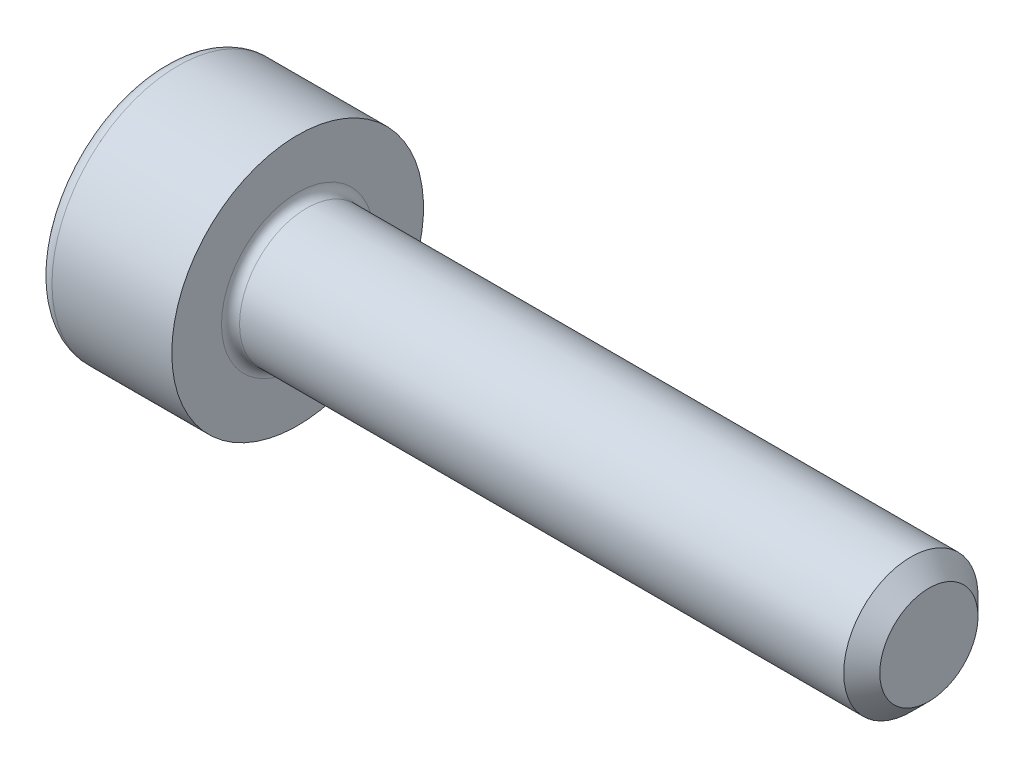
from build123d import *

# Parameters (mm, degrees)
FILLET1_R      = 0.1
FILLET2_R      = 0.16
CHAMFER1_SIZE  = 0.2
EXTRUDE1_DEPTH = 0.7


with BuildPart() as part:
    # Sketch1 → Revolve1 (revolve)
    with BuildSketch(Plane.XY, mode=Mode.PRIVATE) as revolve1_sk:
        Polygon((0, 1.395688245), (0, 0), (8.488734128, 0), (8.488734128, 0.744367064), (1.488734128, 0.744367064), (1.488734128, 1.395688245), align=None)
    revolve(revolve1_sk.sketch.rotate(Axis((0, 0, 0), (1, 0, 0)), 90), axis=Axis((0, 0, 0), (1, 0, 0)))

    # Fillet1
    fillet1_edges = [part.edges().sort_by_distance(p)[0] for p in [
        (1.488734128, 0, -0.744367064),
    ]]
    fillet(fillet1_edges, radius=FILLET1_R)

    # Fillet2
    fillet2_edges = [part.edges().sort_by_distance(p)[0] for p in [
        (0, 0, -1.395688245),
    ]]
    fillet(fillet2_edges, radius=FILLET2_R)

    # Chamfer1
    chamfer1_edges = [part.edges().sort_by_distance(p)[0] for p in [
        (8.488734128, 0, -0.744367064),
    ]]
    chamfer(chamfer1_edges, length=CHAMFER1_SIZE)

    # Sketch2 → Extrude1 (cut)
    with BuildSketch(Plane.ZY):
        Polygon((0, 0.877572409), (-0.76, 0.438786205), (-0.76, -0.438786205), (0, -0.877572409), (0.76, -0.438786205), (0.76, 0.438786205), align=None)
    extrude(amount=-EXTRUDE1_DEPTH, mode=Mode.SUBTRACT)


solid = part.part
